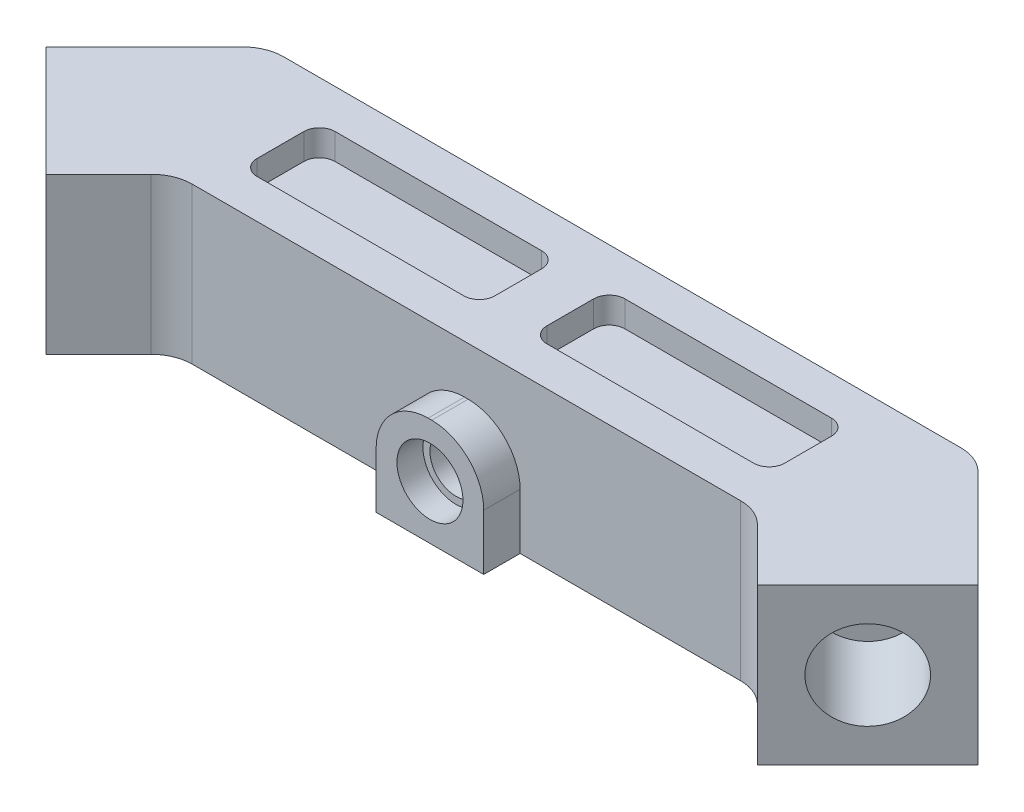
from build123d import *

# Parameters (mm, degrees)
BOSS_EXTRUDE1_DEPTH = 38.1
SKETCH2_R           = 10.8585
CUT_EXTRUDE1_DEPTH  = 25.4
SKETCH3_R           = 10.8585
CUT_EXTRUDE2_DEPTH  = 25.4
FILLET1_R           = 10
FILLET2_R           = 10
SKETCH5_W           = 26.289
SKETCH5_H           = 26.289
BOSS_EXTRUDE2_DEPTH = 8.89
SKETCH6_R           = 8.0645
CUT_EXTRUDE3_DEPTH  = 6.35
SKETCH7_R           = 6.35
CUT_EXTRUDE4_DEPTH  = 5.08
FILLET3_R           = 12.7
SKETCH8_W           = 58.1046987
SKETCH8_H           = 19.05
CUT_EXTRUDE5_DEPTH  = 6.35
FILLET4_R           = 3.81


with BuildPart() as part:
    # Sketch1 → Boss-Extrude1 (new body)
    with BuildSketch(Plane(origin=(0, 0, 0), x_dir=(1, 0, 0), z_dir=(0, 1, 0))):
        Polygon((0, 0), (142.24, 0), (158.021536726, -15.781536726), (184.96230509, 11.159231637), (158.021536726, 38.1), (-15.781536726, 38.1), (-42.72230509, 11.159231637), (-15.781536726, -15.781536726), align=None)
    extrude(amount=BOSS_EXTRUDE1_DEPTH)

    # Sketch2 → Cut-Extrude1 (cut)
    with BuildSketch(Plane(origin=(-15.781536726, 0, 15.781536726), x_dir=(0.7071067811865477, 0, 0.7071067811865475), z_dir=(-0.7071067811865475, 0, 0.7071067811865477))):
        with Locations((-19.05, 19.05)):
            Circle(SKETCH2_R)
    extrude(amount=-CUT_EXTRUDE1_DEPTH, mode=Mode.SUBTRACT)

    # Sketch3 → Cut-Extrude2 (cut)
    with BuildSketch(Plane(origin=(86.901536726, 0, 86.901536726), x_dir=(0.7071067811865478, 0, -0.7071067811865474), z_dir=(0.7071067811865474, 0, 0.7071067811865478))):
        with Locations((119.628868556, 19.05)):
            Circle(SKETCH3_R)
    extrude(amount=-CUT_EXTRUDE2_DEPTH, mode=Mode.SUBTRACT)

    # Fillet1
    fillet1_edges = [part.edges().sort_by_distance(p)[0] for p in [
        (142.24, 19.05, 0),
        (0, 19.05, 0),
    ]]
    fillet(fillet1_edges, radius=FILLET1_R)

    # Fillet2
    fillet2_edges = [part.edges().sort_by_distance(p)[0] for p in [
        (-15.781536726, 19.05, -38.1),
        (158.021536726, 19.05, -38.1),
    ]]
    fillet(fillet2_edges, radius=FILLET2_R)

    # Sketch5 → Boss-Extrude2 (add)
    with BuildSketch(Plane.XY):
        with Locations((71.12, 13.1445)):
            Rectangle(SKETCH5_W, SKETCH5_H)
    extrude(amount=BOSS_EXTRUDE2_DEPTH)

    # Sketch6 → Cut-Extrude3 (cut)
    with BuildSketch(Plane.XY.offset(8.89)):
        with Locations((71.12, 13.1445)):
            Circle(SKETCH6_R)
    extrude(amount=-CUT_EXTRUDE3_DEPTH, mode=Mode.SUBTRACT)

    # Sketch7 → Cut-Extrude4 (cut)
    with BuildSketch(Plane.XY.offset(2.54)):
        with Locations((71.12, 13.1445)):
            Circle(SKETCH7_R)
    extrude(amount=-CUT_EXTRUDE4_DEPTH, mode=Mode.SUBTRACT)

    # Fillet3
    fillet3_edges = [part.edges().sort_by_distance(p)[0] for p in [
        (57.9755, 26.289, 4.445),
        (84.2645, 26.289, 4.445),
    ]]
    fillet(fillet3_edges, radius=FILLET3_R)

    # Sketch8 → Cut-Extrude5 (cut)
    with BuildSketch(Plane(origin=(0, 38.1, 0), x_dir=(1, 0, 0), z_dir=(0, 1, 0))):
        with Locations((35.71765065, 19.05)):
            Rectangle(SKETCH8_W, SKETCH8_H)
        with Locations((106.52234935, 19.05)):
            Rectangle(SKETCH8_W, SKETCH8_H)
    extrude(amount=-CUT_EXTRUDE5_DEPTH, mode=Mode.SUBTRACT)

    # Fillet4
    fillet4_edges = [part.edges().sort_by_distance(p)[0] for p in [
        (6.6653013, 34.925, -9.525),
        (6.6653013, 34.925, -28.575),
        (64.77, 34.925, -28.575),
        (64.77, 34.925, -9.525),
        (135.5746987, 34.925, -28.575),
        (135.5746987, 34.925, -9.525),
        (77.47, 34.925, -9.525),
        (77.47, 34.925, -28.575),
    ]]
    fillet(fillet4_edges, radius=FILLET4_R)


solid = part.part
